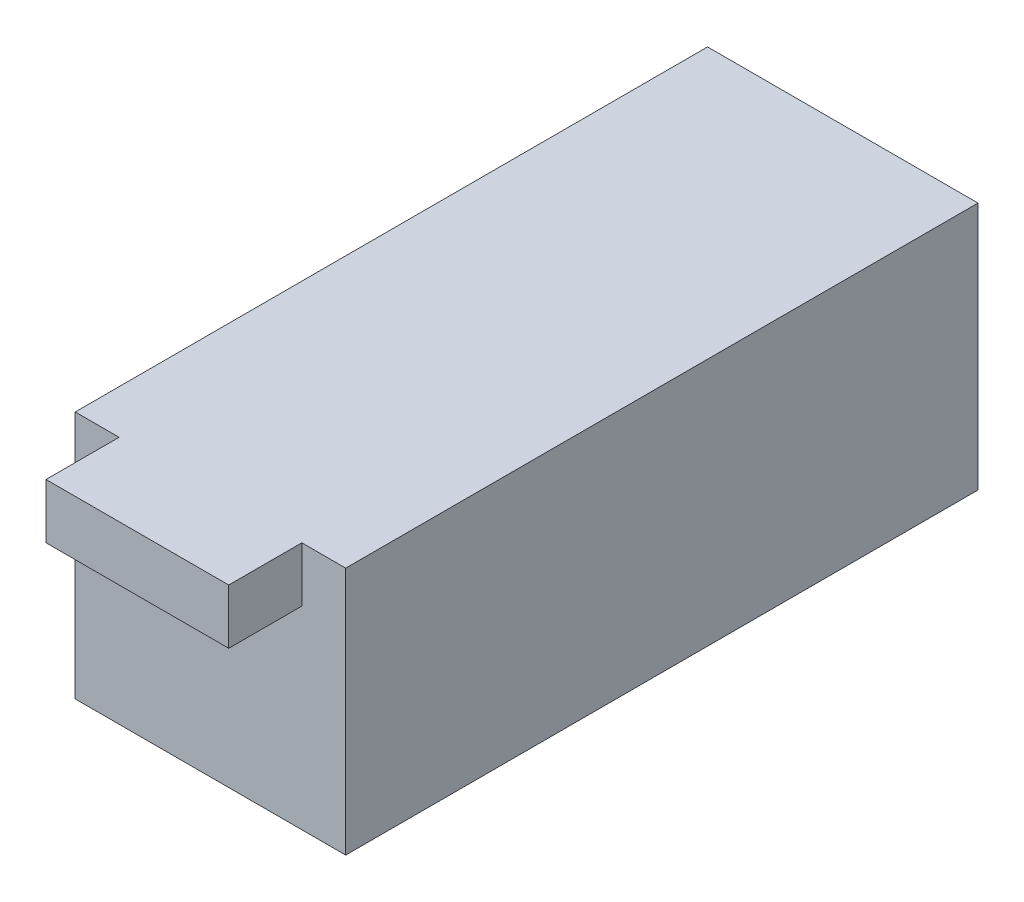
from build123d import *

# Parameters (mm, degrees)
SKETCH2_W           = 74
SKETCH2_H           = 68
BOSS_EXTRUDE1_DEPTH = 173
SKETCH3_W           = 50
SKETCH3_H           = 15
BOSS_EXTRUDE2_DEPTH = 20


with BuildPart() as part:
    # Sketch2 → Boss-Extrude1 (new body)
    with BuildSketch(Plane.XY):
        Rectangle(SKETCH2_W, SKETCH2_H)
    extrude(amount=BOSS_EXTRUDE1_DEPTH)

    # Sketch3 → Boss-Extrude2 (add)
    with BuildSketch(Plane.XY.offset(173)):
        with Locations((0, 26.5)):
            Rectangle(SKETCH3_W, SKETCH3_H)
    extrude(amount=BOSS_EXTRUDE2_DEPTH)


solid = part.part
